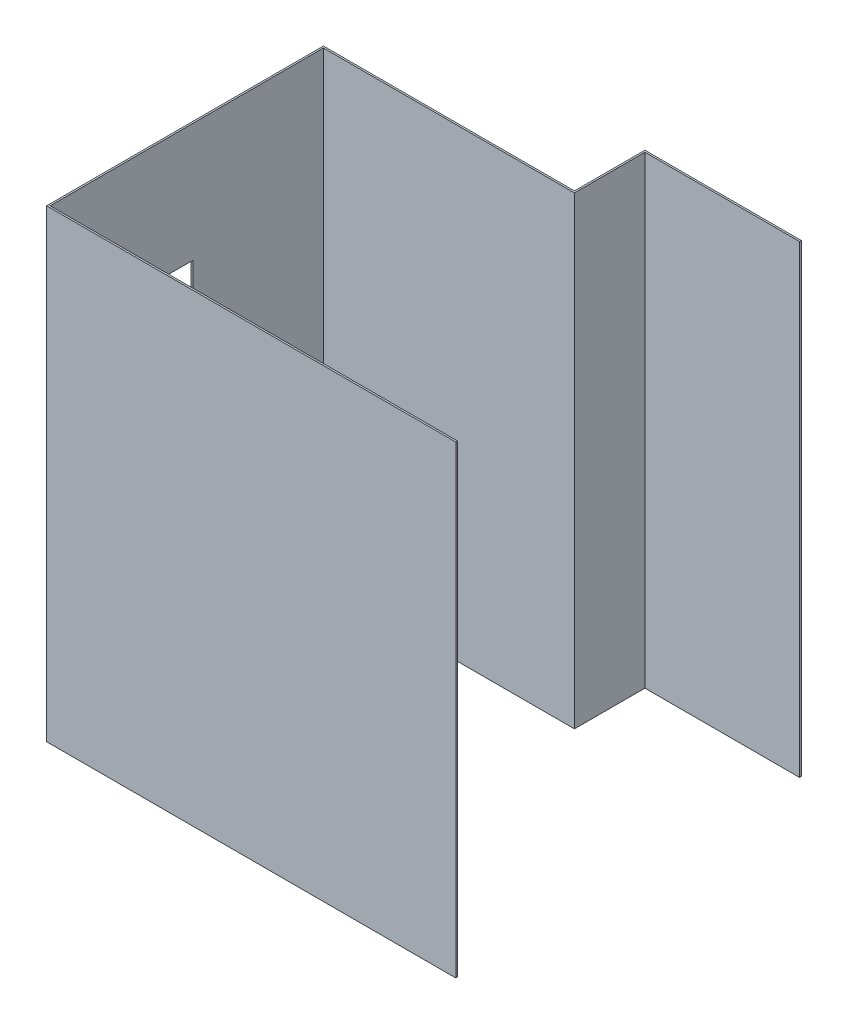
from build123d import *

# Parameters (mm, degrees)
SKETCH1_W           = 1460
SKETCH1_H           = 2700
BOSS_EXTRUDE1_DEPTH = 10
SKETCH2_W           = 410
SKETCH2_H           = 2700
BOSS_EXTRUDE2_DEPTH = 10
SKETCH3_W           = 910
SKETCH3_H           = 2700
BOSS_EXTRUDE3_DEPTH = 10
SKETCH4_W           = 1600
SKETCH4_H           = 2700
BOSS_EXTRUDE4_DEPTH = 10
SKETCH5_W           = 2380
SKETCH5_H           = 2700
BOSS_EXTRUDE5_DEPTH = 10
CUT_EXTRUDE1_REACH  = 3169.254
SKETCH6_W           = 580
SKETCH6_H           = 2010


with BuildPart() as part:
    # Sketch1 → Boss-Extrude1 (new body)
    with BuildSketch(Plane.XY):
        Rectangle(SKETCH1_W, SKETCH1_H)
    extrude(amount=BOSS_EXTRUDE1_DEPTH)

    # Sketch2 → Boss-Extrude2 (add)
    with BuildSketch(Plane(origin=(730, 0, 0), x_dir=(0, 0, -1), z_dir=(1, 0, 0))):
        with Locations((195, 0)):
            Rectangle(SKETCH2_W, SKETCH2_H)
    extrude(amount=-BOSS_EXTRUDE2_DEPTH)

    # Sketch3 → Boss-Extrude3 (add)
    with BuildSketch(Plane(origin=(0, 0, -400), x_dir=(-1, 0, 0), z_dir=(0, 0, -1))):
        with Locations((-1175, 0)):
            Rectangle(SKETCH3_W, SKETCH3_H)
    extrude(amount=BOSS_EXTRUDE3_DEPTH)

    # Sketch4 → Boss-Extrude4 (add)
    with BuildSketch(Plane.ZY.offset(730)):
        with Locations((800, 0)):
            Rectangle(SKETCH4_W, SKETCH4_H)
    extrude(amount=BOSS_EXTRUDE4_DEPTH)

    # Sketch5 → Boss-Extrude5 (add)
    with BuildSketch(Plane.XY.offset(1600)):
        with Locations((450, 0)):
            Rectangle(SKETCH5_W, SKETCH5_H)
    extrude(amount=BOSS_EXTRUDE5_DEPTH)

    # Sketch6 → Cut-Extrude1 (cut, up to next)
    with BuildSketch(Plane(origin=(-730, 0, 0), x_dir=(0, 0, -1), z_dir=(1, 0, 0)), mode=Mode.PRIVATE) as cut_extrude1_sk1:
        with Locations((-1060, -345)):
            Rectangle(SKETCH6_W, SKETCH6_H)
    cut_extrude1_tool1 = extrude(cut_extrude1_sk1.sketch, amount=-CUT_EXTRUDE1_REACH, mode=Mode.PRIVATE) & part.part
    add(cut_extrude1_tool1.solids().sort_by_distance((-730, -345, 1060))[0], mode=Mode.SUBTRACT)


solid = part.part
